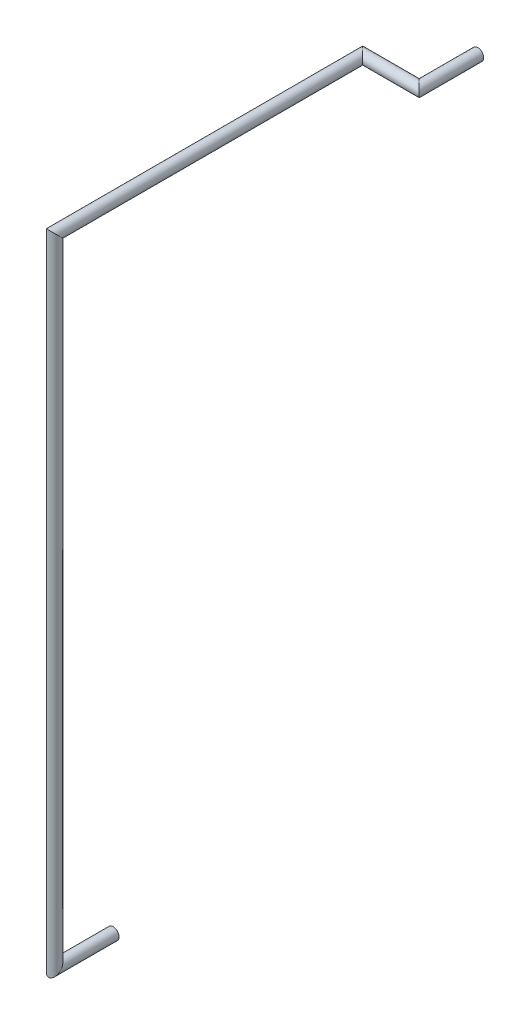
from build123d import *

# Parameters (mm, degrees)
ESQUISSE1_R = 0.5


with BuildPart() as part:
    # Balayage1: sweep along a curve in space
    with BuildLine() as balayage1_path:
        Line((0, 0, 0), (0, 0, 5))
        Line((0, 0, 5), (0, 54.22, 5))
        Line((0, 54.22, 5), (0, 54.22, -21.29))
        Line((0, 54.22, -21.29), (4.82, 54.22, -21.29))
        Line((4.82, 54.22, -21.29), (4.82, 54.22, -26.29))
    # Esquisse1 → Balayage1 (sweep)
    with BuildSketch(Plane(origin=(0, 0, 0), x_dir=(0, 1, 0), z_dir=(0, 0, 1))):
        Circle(ESQUISSE1_R)
    sweep(path=balayage1_path.line, transition=Transition.RIGHT)


solid = part.part
